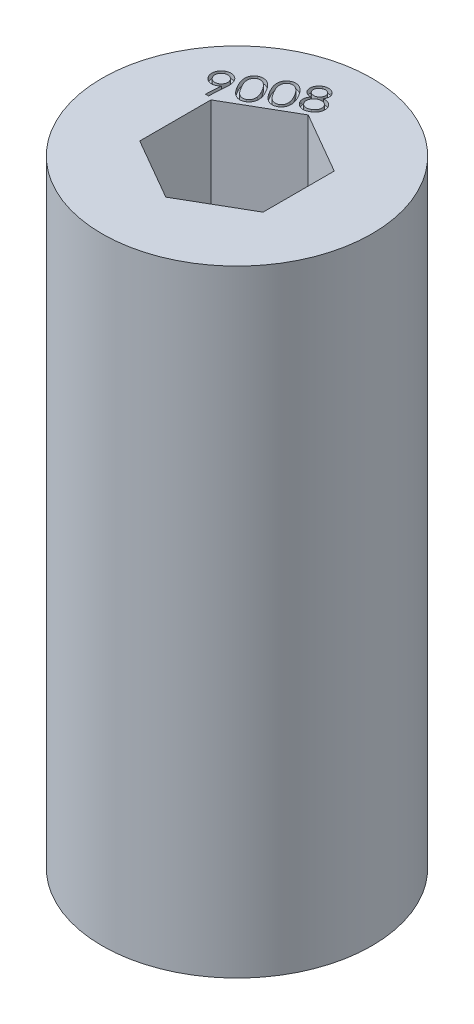
from build123d import *

# Parameters (mm, degrees)
SKETCH1_R           = 11.1125
BOSS_EXTRUDE1_DEPTH = 50.8
CUT_EXTRUDE1_DEPTH  = 0.4


with BuildPart() as part:
    # Sketch1 → Boss-Extrude1 (new body)
    with BuildSketch(Plane(origin=(0, 0, 0), x_dir=(1, 0, 0), z_dir=(0, 1, 0))):
        with Locations(Location((0, 0, 0), (0, 0, 270))):
            Circle(SKETCH1_R)
        Polygon((0, 5.865878735), (-5.08, 2.932939367), (-5.08, -2.932939367), (0, -5.865878735), (5.08, -2.932939367), (5.08, 2.932939367), align=None, mode=Mode.SUBTRACT)
    extrude(amount=BOSS_EXTRUDE1_DEPTH)

    # Sketch2 → Cut-Extrude1 (cut)
    # profile 1 of 4: a face of its own
    with BuildSketch(Plane(origin=(0, 50.8, 0), x_dir=(1, 0, 0), z_dir=(0, 1, 0))):
        with BuildLine():
            Line((-5.464233288, 3.106271191), (-5.712025756, 3.11848273))
            Line((-5.712025756, 3.11848273), (-5.638756525, 4.361515582))
            add(Edge.make_bspline(
                [(-5.638756525, 4.361515582), (-5.654742541, 4.34408663), (-5.685838885, 4.310183457), (-5.736339603, 4.265466689), (-5.786909982, 4.225649834), (-5.822721968, 4.20379365), (-5.84024691, 4.193098114)],
                knots=[0, 0, 0, 0, 1.07557127, 2.092224476, 3.066411598, 4, 4, 4, 4], degree=3))
            add(Edge.make_bspline(
                [(-5.84024691, 4.193098114), (-5.861905443, 4.181279532), (-5.904757805, 4.157895945), (-5.972054319, 4.131180701), (-6.040184027, 4.111394414), (-6.10936375, 4.100009922), (-6.179205016, 4.094550923), (-6.250185789, 4.097279675), (-6.321893014, 4.107639052), (-6.393746238, 4.124913062), (-6.464010388, 4.148529635), (-6.53100875, 4.178659981), (-6.593950569, 4.214920767), (-6.652582535, 4.257417881), (-6.707417297, 4.305484502), (-6.757937177, 4.359620171), (-6.804042025, 4.420135677), (-6.830938539, 4.463880923), (-6.844645948, 4.486175037)],
                knots=[0, 0, 0, 0, 1.015135184, 2.008489705, 2.974464217, 3.930823522, 4.890110555, 5.854468119, 6.84900024, 7.868689235, 8.893387844, 9.896732215, 10.888539014, 11.878968029, 12.873598221, 13.886496971, 14.922884625, 16, 16, 16, 16], degree=3))
            add(Edge.make_bspline(
                [(-6.844645948, 4.486175037), (-6.861489422, 4.517654922), (-6.89462857, 4.579590872), (-6.928183399, 4.678195714), (-6.95004064, 4.7778869), (-6.956050764, 4.878986517), (-6.950014984, 4.97987807), (-6.928546851, 5.07891092), (-6.894084706, 5.175574672), (-6.846407384, 5.268539991), (-6.787073873, 5.355536721), (-6.718339337, 5.434630756), (-6.639033964, 5.503366935), (-6.579910215, 5.540503596), (-6.550042583, 5.55926398)],
                knots=[0, 0, 0, 0, 1.035324533, 2.036977218, 3.013660684, 3.991039457, 4.968418229, 5.940283026, 6.923354643, 7.941094773, 8.965736768, 9.974485588, 10.976767849, 12, 12, 12, 12], degree=3))
            add(Edge.make_bspline(
                [(-6.550042583, 5.55926398), (-6.51957095, 5.575567897), (-6.459310938, 5.607810156), (-6.362638027, 5.640629179), (-6.263280159, 5.660753245), (-6.162026986, 5.667744951), (-6.060665863, 5.661961709), (-5.96175838, 5.641793645), (-5.865839738, 5.608535513), (-5.77518211, 5.560963725), (-5.690264574, 5.503300132), (-5.613904084, 5.435854133), (-5.547346225, 5.358895811), (-5.511353355, 5.301628285), (-5.493235692, 5.27280164)],
                knots=[0, 0, 0, 0, 1.019400264, 2.015942902, 3.002372847, 4.006779929, 5.005536382, 5.991966327, 6.979044859, 7.994053264, 9.007032045, 10.004279611, 10.995418019, 12, 12, 12, 12], degree=3))
            add(Edge.make_bspline(
                [(-5.493235692, 5.27280164), (-5.480740701, 5.249444054), (-5.455312696, 5.201910063), (-5.42504166, 5.125103763), (-5.400793373, 5.042801489), (-5.385071268, 4.970279705), (-5.375814114, 4.908612375), (-5.369989764, 4.85840008), (-5.366949763, 4.804715519), (-5.363998973, 4.747569389), (-5.3638075, 4.687150177), (-5.364814512, 4.623198069), (-5.36732965, 4.555845676), (-5.370174596, 4.509744836), (-5.371629121, 4.486175037)],
                knots=[0, 0, 0, 0, 1.179517641, 2.400384276, 3.669978525, 4.99951221, 5.702757638, 6.447991837, 7.250775919, 8.098000084, 8.997311831, 9.942054579, 10.947842213, 12, 12, 12, 12], degree=3))
            Line((-5.371629121, 4.486175037), (-5.464233288, 3.106271191))
        make_face()
        with BuildLine():
            add(Edge.make_bspline(
                [(-5.900795788, 4.414941063), (-5.88514732, 4.42446378), (-5.85441488, 4.443165694), (-5.812585098, 4.476242209), (-5.77446958, 4.511756411), (-5.741419829, 4.551327754), (-5.712214626, 4.593714055), (-5.687270228, 4.639265166), (-5.666086076, 4.687861045), (-5.650365153, 4.739333437), (-5.638317651, 4.791836686), (-5.632556762, 4.844566461), (-5.630618693, 4.896504821), (-5.634740047, 4.947896965), (-5.644703983, 4.998230386), (-5.658852589, 5.048126749), (-5.678837626, 5.097171444), (-5.695787063, 5.128614516), (-5.704393544, 5.144580486)],
                knots=[0, 0, 0, 0, 1.045108442, 2.052516081, 3.039037663, 4.014948609, 4.990090363, 5.974041511, 6.976128051, 8.011453109, 9.043011603, 10.047295345, 11.035574291, 12.007150616, 12.98344593, 13.961229243, 14.964765542, 16, 16, 16, 16], degree=3))
            add(Edge.make_bspline(
                [(-5.704393544, 5.144580486), (-5.713749183, 5.160054721), (-5.732239817, 5.190638244), (-5.765021987, 5.232272859), (-5.800881741, 5.269882455), (-5.840243743, 5.302972145), (-5.882681599, 5.332095795), (-5.928081699, 5.357218363), (-5.976939709, 5.377604273), (-6.028251361, 5.393593544), (-6.080830508, 5.405287058), (-6.13345449, 5.412156772), (-6.185475356, 5.413059533), (-6.236761796, 5.408959251), (-6.28748991, 5.39991044), (-6.337446419, 5.384762938), (-6.387156065, 5.365263493), (-6.418607621, 5.347796631), (-6.434541781, 5.338947473)],
                knots=[0, 0, 0, 0, 1.031712043, 2.039092063, 3.018573684, 3.994457873, 4.969572892, 5.953497063, 6.951758218, 7.98705489, 9.018585102, 10.024008046, 11.012022604, 11.983572292, 12.958061913, 13.947831088, 14.960318852, 16, 16, 16, 16], degree=3))
            add(Edge.make_bspline(
                [(-6.434541781, 5.338947473), (-6.450048329, 5.329631062), (-6.480581237, 5.311286739), (-6.52175729, 5.277968238), (-6.559879905, 5.242671466), (-6.592856414, 5.203041914), (-6.622204876, 5.16083074), (-6.646428382, 5.1149783), (-6.667765763, 5.066558569), (-6.683434864, 5.015057886), (-6.695496677, 4.962562222), (-6.701233977, 4.909999311), (-6.703190189, 4.858232177), (-6.699068034, 4.807009125), (-6.689107962, 4.756675798), (-6.674958314, 4.70677941), (-6.65497356, 4.657734721), (-6.638024083, 4.626291648), (-6.629417583, 4.610325678)],
                knots=[0, 0, 0, 0, 1.034021631, 2.036022986, 3.024725885, 4.002794686, 4.980092595, 5.961574923, 6.965877195, 8.00349148, 9.037330872, 10.043835206, 11.024597356, 11.998321951, 12.97677597, 13.956721278, 14.962476515, 16, 16, 16, 16], degree=3))
            add(Edge.make_bspline(
                [(-6.629417583, 4.610325678), (-6.620062349, 4.594850826), (-6.601572518, 4.564266083), (-6.568784497, 4.522640368), (-6.532946249, 4.48499806), (-6.493611883, 4.452119087), (-6.451596804, 4.422609013), (-6.406095382, 4.397841411), (-6.357519633, 4.376626967), (-6.306041644, 4.360914466), (-6.253539897, 4.348864703), (-6.200809733, 4.343104402), (-6.148871474, 4.34116618), (-6.097479303, 4.345287574), (-6.047145889, 4.355251499), (-5.997249524, 4.369400108), (-5.94820483, 4.389385145), (-5.916761757, 4.406334582), (-5.900795788, 4.414941063)],
                knots=[0, 0, 0, 0, 1.033571637, 2.042767394, 3.024014467, 4.001657624, 4.970548117, 5.956245748, 6.96011096, 7.997273687, 9.030663166, 10.03672948, 11.026762591, 12.000063433, 12.97809164, 13.957610489, 14.962928033, 16, 16, 16, 16], degree=3))
        make_face(mode=Mode.SUBTRACT)
    # profile 2 of 4: a face of its own
    with BuildSketch(Plane(origin=(0, 50.8, 0), x_dir=(1, 0, 0), z_dir=(0, 1, 0))):
        with BuildLine():
            add(Edge.make_bspline(
                [(-4.928687339, 4.954284012), (-4.948793485, 4.989588384), (-4.987897002, 5.058250228), (-5.040534024, 5.160657731), (-5.08765215, 5.258189022), (-5.127949969, 5.351356455), (-5.161795398, 5.439913028), (-5.188764868, 5.524041803), (-5.210138255, 5.603572354), (-5.224388486, 5.679306014), (-5.233119809, 5.751740457), (-5.237101698, 5.821413184), (-5.237356211, 5.888883823), (-5.232771229, 5.954186678), (-5.223705939, 6.01730867), (-5.209932829, 6.078228239), (-5.191476099, 6.136839676), (-5.169120362, 6.193332415), (-5.142952651, 6.247331226), (-5.111849294, 6.297693297), (-5.078678107, 6.345800774), (-5.041121008, 6.39000032), (-5.000873044, 6.431760197), (-4.956409405, 6.469583201), (-4.90905379, 6.505176436), (-4.875108239, 6.525780064), (-4.857962178, 6.536187056)],
                knots=[0, 0, 0, 0, 1.642217524, 3.193873097, 4.653599743, 6.020219012, 7.296149585, 8.484364078, 9.590266645, 10.622995624, 11.596731579, 12.537641419, 13.442669779, 14.322439731, 15.181528583, 16.018162769, 16.844365298, 17.663022962, 18.472528165, 19.266229043, 20.053716379, 20.832379209, 21.608138827, 22.395685855, 23.18965321, 24, 24, 24, 24], degree=3))
            add(Edge.make_bspline(
                [(-4.857962178, 6.536187056), (-4.84013454, 6.545988782), (-4.804791488, 6.565420571), (-4.749447636, 6.58905243), (-4.69370601, 6.609216691), (-4.636620844, 6.623997977), (-4.578762578, 6.634121613), (-4.519731728, 6.639774528), (-4.459848145, 6.640750937), (-4.399144164, 6.637089566), (-4.337812434, 6.62914793), (-4.276399155, 6.615310678), (-4.215177301, 6.596125234), (-4.153605772, 6.57299638), (-4.092924308, 6.543097982), (-4.031973214, 6.508743479), (-3.970843719, 6.469752408), (-3.910268702, 6.424544749), (-3.849003653, 6.373917511), (-3.788382954, 6.31590064), (-3.727494497, 6.250915058), (-3.667251705, 6.178716746), (-3.607196679, 6.099335471), (-3.546422586, 6.01346862), (-3.486709796, 5.919760167), (-3.448017599, 5.85432078), (-3.42819455, 5.820794428)],
                knots=[0, 0, 0, 0, 0.815881076, 1.617473213, 2.411751612, 3.192532544, 3.980223438, 4.766442947, 5.569622482, 6.380892254, 7.204795063, 8.048528362, 8.903143009, 9.777765604, 10.684831081, 11.614241792, 12.584586996, 13.591843045, 14.645331516, 15.771781295, 16.956234458, 18.217113798, 19.542884518, 20.949560407, 22.437178076, 24, 24, 24, 24], degree=3))
            add(Edge.make_bspline(
                [(-3.42819455, 5.820794428), (-3.409190702, 5.7869722), (-3.372127599, 5.721008888), (-3.320894818, 5.622901727), (-3.276888393, 5.527798763), (-3.23825745, 5.436480652), (-3.206313147, 5.348637361), (-3.179966056, 5.264332003), (-3.160056454, 5.183454138), (-3.146053551, 5.105772295), (-3.138263238, 5.030928089), (-3.133631325, 4.95892004), (-3.135060527, 4.88924104), (-3.139639736, 4.821845386), (-3.150151576, 4.756797379), (-3.164166869, 4.693954868), (-3.18303456, 4.633690481), (-3.20660177, 4.576124872), (-3.233843758, 4.521260537), (-3.265334897, 4.46972113), (-3.299144903, 4.420716259), (-3.336912934, 4.37504797), (-3.379107514, 4.333531697), (-3.423647626, 4.294224214), (-3.47185414, 4.258099281), (-3.506363462, 4.237247043), (-3.523851601, 4.226679845)],
                knots=[0, 0, 0, 0, 1.558572261, 3.039675171, 4.44500239, 5.767404933, 7.021920233, 8.19867626, 9.314183841, 10.366093107, 11.366862767, 12.335955634, 13.262731656, 14.164729598, 15.047477431, 15.907015182, 16.749641984, 17.580952634, 18.403702246, 19.207672054, 20.005351578, 20.794016824, 21.584181799, 22.380929523, 23.179510693, 24, 24, 24, 24], degree=3))
            add(Edge.make_bspline(
                [(-3.523851601, 4.226679845), (-3.541367865, 4.217115449), (-3.576147998, 4.198124471), (-3.630084616, 4.174010379), (-3.685420625, 4.15543098), (-3.741225332, 4.140280622), (-3.798182967, 4.130921886), (-3.855799048, 4.125083823), (-3.914496656, 4.12422767), (-3.973914032, 4.127567424), (-4.03355512, 4.13656122), (-4.093299441, 4.149399628), (-4.152422207, 4.168795119), (-4.211709801, 4.192092469), (-4.270804517, 4.220821596), (-4.329860864, 4.254356104), (-4.388455415, 4.293401204), (-4.447492568, 4.337214273), (-4.506145932, 4.388061163), (-4.565467307, 4.445960184), (-4.625319129, 4.511487517), (-4.685255803, 4.585124536), (-4.745975243, 4.666184451), (-4.806581705, 4.755280679), (-4.868578792, 4.851586182), (-4.90824727, 4.919361346), (-4.928687339, 4.954284012)],
                knots=[0, 0, 0, 0, 0.807491903, 1.603348545, 2.386916451, 3.167713854, 3.940658363, 4.719915701, 5.50935356, 6.313835313, 7.125313705, 7.947948844, 8.783651521, 9.640150085, 10.524255013, 11.440287308, 12.386399569, 13.372019105, 14.413529699, 15.525036669, 16.724996316, 18.002813491, 19.365932914, 20.822335035, 22.362637201, 24, 24, 24, 24], degree=3))
        make_face()
        with BuildLine():
            add(Edge.make_bspline(
                [(-4.718547114, 5.069784813), (-4.70108648, 5.039827411), (-4.667275062, 4.981816791), (-4.615222732, 4.899258903), (-4.564339812, 4.823520983), (-4.515229323, 4.75413604), (-4.466971574, 4.691884002), (-4.419519097, 4.636916859), (-4.37381687, 4.588199154), (-4.328724806, 4.546096025), (-4.283896023, 4.509550177), (-4.239087362, 4.477336139), (-4.193809127, 4.449386933), (-4.148466892, 4.42530407), (-4.102694317, 4.405313478), (-4.056733088, 4.388831973), (-4.010111692, 4.377351461), (-3.94905364, 4.366415974), (-3.874075679, 4.362228962), (-3.787437682, 4.37088435), (-3.705448212, 4.392270684), (-3.65593415, 4.417572222), (-3.631211377, 4.430205486)],
                knots=[0, 0, 0, 0, 1.475228016, 2.856686104, 4.15161897, 5.357081144, 6.47289893, 7.501387829, 8.445726694, 9.313720896, 10.124066195, 10.905058304, 11.660046733, 12.386348828, 13.08755313, 13.783651734, 14.460982071, 15.127735434, 16.421461315, 17.639985157, 18.821625413, 20, 20, 20, 20], degree=3))
            add(Edge.make_bspline(
                [(-3.631211377, 4.430205486), (-3.607710095, 4.445359707), (-3.560973482, 4.475496658), (-3.501138516, 4.535227097), (-3.451132416, 4.605126996), (-3.417699965, 4.67090562), (-3.397074331, 4.728014329), (-3.384042229, 4.773303827), (-3.375688418, 4.820890891), (-3.370374372, 4.870198879), (-3.369820308, 4.921398884), (-3.371555498, 4.974441182), (-3.377801327, 5.029337053), (-3.384559059, 5.066258827), (-3.387998236, 5.085049236)],
                knots=[0, 0, 0, 0, 1.342886321, 2.670576022, 4.038999414, 5.466462105, 6.205051725, 6.959707281, 7.731476591, 8.527516338, 9.344012544, 10.193626534, 11.080691652, 12, 12, 12, 12], degree=3))
            add(Edge.make_bspline(
                [(-3.387998236, 5.085049236), (-3.392801514, 5.108860677), (-3.402577303, 5.157322507), (-3.422901628, 5.230025483), (-3.446791032, 5.30461487), (-3.475175086, 5.380502959), (-3.508171229, 5.457724584), (-3.544673502, 5.536619378), (-3.585892775, 5.617095001), (-3.616251638, 5.670467085), (-3.631720191, 5.697661415)],
                knots=[0, 0, 0, 0, 0.879876913, 1.790754508, 2.73331625, 3.717259664, 4.725112015, 5.77538776, 6.866507818, 8, 8, 8, 8], degree=3))
            add(Edge.make_bspline(
                [(-3.631720191, 5.697661415), (-3.647453671, 5.724587266), (-3.678237596, 5.777270043), (-3.726831457, 5.852249655), (-3.774472981, 5.92287403), (-3.822793775, 5.988121293), (-3.871695744, 6.0479169), (-3.91994551, 6.103347831), (-3.968824147, 6.153162936), (-4.017781593, 6.19812882), (-4.066624645, 6.238253262), (-4.114791843, 6.274124811), (-4.163081279, 6.304758041), (-4.210816348, 6.331487525), (-4.258543059, 6.353215883), (-4.3057272, 6.370883174), (-4.352730646, 6.383729554), (-4.41398708, 6.394172282), (-4.488519222, 6.398470643), (-4.574584024, 6.390621994), (-4.655780875, 6.369035549), (-4.704835434, 6.344063418), (-4.72923221, 6.331643787)],
                knots=[0, 0, 0, 0, 1.327522451, 2.597413504, 3.803087542, 4.954092809, 6.052504639, 7.091116491, 8.08170511, 9.022070092, 9.919800897, 10.771882377, 11.577119672, 12.352806521, 13.099205072, 13.807429758, 14.495830891, 15.170113202, 16.450227669, 17.661618134, 18.837030004, 20, 20, 20, 20], degree=3))
            add(Edge.make_bspline(
                [(-4.72923221, 6.331643787), (-4.752768129, 6.316521097), (-4.799674133, 6.28638227), (-4.8592186, 6.225893802), (-4.910252136, 6.155599587), (-4.943263344, 6.08855477), (-4.965224395, 6.030984494), (-4.977011098, 5.984968735), (-4.986395219, 5.937447555), (-4.99210498, 5.887932881), (-4.993156653, 5.836569144), (-4.992055344, 5.783509077), (-4.985872707, 5.728876939), (-4.977526021, 5.671848526), (-4.963998074, 5.611639902), (-4.944976408, 5.547456033), (-4.92025291, 5.47884545), (-4.890752643, 5.4054349), (-4.855506683, 5.327826709), (-4.815021598, 5.245587731), (-4.769487317, 5.158729475), (-4.735872529, 5.100036031), (-4.718547114, 5.069784813)],
                knots=[0, 0, 0, 0, 1.186584607, 2.364808541, 3.584028067, 4.867913378, 5.52979883, 6.201670858, 6.884946004, 7.589109066, 8.317961587, 9.068444384, 9.84432244, 10.65432116, 11.518850237, 12.466086659, 13.499587148, 14.619373863, 15.830028341, 17.123623296, 18.517485242, 20, 20, 20, 20], degree=3))
        make_face(mode=Mode.SUBTRACT)
    # profile 3 of 4: a face of its own
    with BuildSketch(Plane(origin=(0, 50.8, 0), x_dir=(1, 0, 0), z_dir=(0, 1, 0))):
        with BuildLine():
            add(Edge.make_bspline(
                [(-3.236606934, 5.931207088), (-3.256713081, 5.96651146), (-3.295816598, 6.035173305), (-3.348453619, 6.137580808), (-3.395571746, 6.235112098), (-3.435869564, 6.328279532), (-3.469714994, 6.416836105), (-3.496684464, 6.50096488), (-3.518057851, 6.580495431), (-3.532308082, 6.656229091), (-3.541039405, 6.728663534), (-3.545021294, 6.798336261), (-3.545275807, 6.8658069), (-3.540690825, 6.931109755), (-3.531625534, 6.994231747), (-3.517852425, 7.055151315), (-3.499395695, 7.113762753), (-3.477039958, 7.170255492), (-3.450872246, 7.224254303), (-3.41976889, 7.274616373), (-3.386597703, 7.322723851), (-3.349040604, 7.366923397), (-3.30879264, 7.408683274), (-3.264329, 7.446506278), (-3.216973386, 7.482099513), (-3.183027835, 7.502703141), (-3.165881774, 7.513110133)],
                knots=[0, 0, 0, 0, 1.642217524, 3.193873097, 4.653599743, 6.020219012, 7.296149585, 8.484364078, 9.590266645, 10.622995624, 11.596731579, 12.537641419, 13.442669779, 14.322439731, 15.181528583, 16.018162769, 16.844365298, 17.663022962, 18.472528165, 19.266229043, 20.053716379, 20.832379209, 21.608138827, 22.395685855, 23.18965321, 24, 24, 24, 24], degree=3))
            add(Edge.make_bspline(
                [(-3.165881774, 7.513110133), (-3.148054136, 7.522911859), (-3.112711083, 7.542343648), (-3.057367231, 7.565975507), (-3.001625606, 7.586139768), (-2.94454044, 7.600921054), (-2.886682174, 7.61104469), (-2.827651324, 7.616697605), (-2.76776774, 7.617674014), (-2.70706376, 7.614012643), (-2.645732029, 7.606071007), (-2.584318751, 7.592233755), (-2.523096897, 7.573048311), (-2.461525367, 7.549919457), (-2.400843903, 7.520021059), (-2.339892809, 7.485666556), (-2.278763315, 7.446675485), (-2.218188298, 7.401467826), (-2.156923249, 7.350840588), (-2.09630255, 7.292823717), (-2.035414092, 7.227838135), (-1.975171301, 7.155639823), (-1.915116275, 7.076258548), (-1.854342182, 6.990391697), (-1.794629391, 6.896683244), (-1.755937195, 6.831243857), (-1.736114146, 6.797717505)],
                knots=[0, 0, 0, 0, 0.815881076, 1.617473213, 2.411751612, 3.192532544, 3.980223438, 4.766442947, 5.569622482, 6.380892254, 7.204795063, 8.048528362, 8.903143009, 9.777765604, 10.684831081, 11.614241792, 12.584586996, 13.591843045, 14.645331516, 15.771781295, 16.956234458, 18.217113798, 19.542884518, 20.949560407, 22.437178076, 24, 24, 24, 24], degree=3))
            add(Edge.make_bspline(
                [(-1.736114146, 6.797717505), (-1.717110298, 6.763895277), (-1.680047195, 6.697931965), (-1.628814413, 6.599824804), (-1.584807988, 6.504721839), (-1.546177046, 6.413403729), (-1.514232743, 6.325560438), (-1.487885652, 6.24125508), (-1.46797605, 6.160377215), (-1.453973146, 6.082695372), (-1.446182834, 6.007851166), (-1.44155092, 5.935843116), (-1.442980123, 5.866164117), (-1.447559332, 5.798768463), (-1.458071172, 5.733720456), (-1.472086465, 5.670877945), (-1.490954156, 5.610613558), (-1.514521365, 5.553047949), (-1.541763353, 5.498183614), (-1.573254493, 5.446644207), (-1.607064499, 5.397639336), (-1.644832529, 5.351971047), (-1.687027109, 5.310454774), (-1.731567222, 5.271147291), (-1.779773736, 5.235022357), (-1.814283058, 5.21417012), (-1.831771197, 5.203602922)],
                knots=[0, 0, 0, 0, 1.558572261, 3.039675171, 4.44500239, 5.767404933, 7.021920233, 8.19867626, 9.314183841, 10.366093107, 11.366862767, 12.335955634, 13.262731656, 14.164729598, 15.047477431, 15.907015182, 16.749641984, 17.580952634, 18.403702246, 19.207672054, 20.005351578, 20.794016824, 21.584181799, 22.380929523, 23.179510693, 24, 24, 24, 24], degree=3))
            add(Edge.make_bspline(
                [(-1.831771197, 5.203602922), (-1.849287461, 5.194038526), (-1.884067594, 5.175047548), (-1.938004212, 5.150933456), (-1.993340221, 5.132354057), (-2.049144928, 5.117203699), (-2.106102563, 5.107844963), (-2.163718644, 5.1020069), (-2.222416251, 5.101150747), (-2.281833628, 5.104490501), (-2.341474716, 5.113484297), (-2.401219037, 5.126322705), (-2.460341803, 5.145718195), (-2.519629397, 5.169015546), (-2.578724112, 5.197744673), (-2.63778046, 5.231279181), (-2.696375011, 5.270324281), (-2.755412164, 5.31413735), (-2.814065528, 5.36498424), (-2.873386903, 5.422883261), (-2.933238725, 5.488410594), (-2.993175399, 5.562047613), (-3.053894839, 5.643107528), (-3.114501301, 5.732203756), (-3.176498388, 5.828509259), (-3.216166866, 5.896284423), (-3.236606934, 5.931207088)],
                knots=[0, 0, 0, 0, 0.807491903, 1.603348545, 2.386916451, 3.167713854, 3.940658363, 4.719915701, 5.50935356, 6.313835313, 7.125313705, 7.947948844, 8.783651521, 9.640150085, 10.524255013, 11.440287308, 12.386399569, 13.372019105, 14.413529699, 15.525036669, 16.724996316, 18.002813491, 19.365932914, 20.822335035, 22.362637201, 24, 24, 24, 24], degree=3))
        make_face()
        with BuildLine():
            add(Edge.make_bspline(
                [(-3.02646671, 6.04670789), (-3.009006076, 6.016750488), (-2.975194658, 5.958739868), (-2.923142328, 5.87618198), (-2.872259407, 5.80044406), (-2.823148919, 5.731059117), (-2.774891169, 5.668807079), (-2.727438693, 5.613839936), (-2.681736466, 5.565122231), (-2.636644402, 5.523019102), (-2.591815618, 5.486473254), (-2.547006958, 5.454259216), (-2.501728723, 5.42631001), (-2.456386487, 5.402227147), (-2.410613913, 5.382236555), (-2.364652683, 5.36575505), (-2.318031287, 5.354274538), (-2.256973236, 5.343339051), (-2.181995274, 5.339152038), (-2.095357278, 5.347807427), (-2.013367807, 5.369193761), (-1.963853746, 5.394495299), (-1.939130973, 5.407128563)],
                knots=[0, 0, 0, 0, 1.475228016, 2.856686104, 4.15161897, 5.357081144, 6.47289893, 7.501387829, 8.445726694, 9.313720896, 10.124066195, 10.905058304, 11.660046733, 12.386348828, 13.08755313, 13.783651734, 14.460982071, 15.127735434, 16.421461315, 17.639985157, 18.821625413, 20, 20, 20, 20], degree=3))
            add(Edge.make_bspline(
                [(-1.939130973, 5.407128563), (-1.915629691, 5.422282784), (-1.868893077, 5.452419735), (-1.809058111, 5.512150174), (-1.759052012, 5.582050073), (-1.725619561, 5.647828697), (-1.704993927, 5.704937406), (-1.691961825, 5.750226904), (-1.683608014, 5.797813968), (-1.678293967, 5.847121956), (-1.677739904, 5.898321961), (-1.679475094, 5.951364259), (-1.685720923, 6.00626013), (-1.692478654, 6.043181904), (-1.695917832, 6.061972313)],
                knots=[0, 0, 0, 0, 1.342886321, 2.670576022, 4.038999414, 5.466462105, 6.205051725, 6.959707281, 7.731476591, 8.527516338, 9.344012544, 10.193626534, 11.080691652, 12, 12, 12, 12], degree=3))
            add(Edge.make_bspline(
                [(-1.695917832, 6.061972313), (-1.70072111, 6.085783754), (-1.710496899, 6.134245584), (-1.730821224, 6.20694856), (-1.754710628, 6.281537947), (-1.783094682, 6.357426036), (-1.816090825, 6.434647661), (-1.852593098, 6.513542455), (-1.893812371, 6.594018078), (-1.924171233, 6.647390162), (-1.939639787, 6.674584492)],
                knots=[0, 0, 0, 0, 0.879876913, 1.790754508, 2.73331625, 3.717259664, 4.725112015, 5.77538776, 6.866507818, 8, 8, 8, 8], degree=3))
            add(Edge.make_bspline(
                [(-1.939639787, 6.674584492), (-1.955373266, 6.701510343), (-1.986157192, 6.75419312), (-2.034751052, 6.829172732), (-2.082392577, 6.899797107), (-2.130713371, 6.96504437), (-2.17961534, 7.024839977), (-2.227865106, 7.080270908), (-2.276743743, 7.130086013), (-2.325701188, 7.175051897), (-2.37454424, 7.215176339), (-2.422711439, 7.251047887), (-2.471000875, 7.281681118), (-2.518735944, 7.308410601), (-2.566462655, 7.33013896), (-2.613646796, 7.34780625), (-2.660650242, 7.360652631), (-2.721906675, 7.371095358), (-2.796438818, 7.37539372), (-2.88250362, 7.367545071), (-2.96370047, 7.345958626), (-3.012755029, 7.320986495), (-3.037151806, 7.308566864)],
                knots=[0, 0, 0, 0, 1.327522451, 2.597413504, 3.803087542, 4.954092809, 6.052504639, 7.091116491, 8.08170511, 9.022070092, 9.919800897, 10.771882377, 11.577119672, 12.352806521, 13.099205072, 13.807429758, 14.495830891, 15.170113202, 16.450227669, 17.661618134, 18.837030004, 20, 20, 20, 20], degree=3))
            add(Edge.make_bspline(
                [(-3.037151806, 7.308566864), (-3.060687725, 7.293444174), (-3.107593729, 7.263305347), (-3.167138195, 7.202816879), (-3.218171731, 7.132522664), (-3.25118294, 7.065477847), (-3.27314399, 7.007907571), (-3.284930694, 6.961891811), (-3.294314814, 6.914370632), (-3.300024575, 6.864855958), (-3.301076249, 6.813492221), (-3.29997494, 6.760432154), (-3.293792303, 6.705800016), (-3.285445616, 6.648771603), (-3.27191767, 6.588562979), (-3.252896003, 6.52437911), (-3.228172506, 6.455768527), (-3.198672238, 6.382357977), (-3.163426279, 6.304749786), (-3.122941194, 6.222510808), (-3.077406913, 6.135652552), (-3.043792125, 6.076959107), (-3.02646671, 6.04670789)],
                knots=[0, 0, 0, 0, 1.186584607, 2.364808541, 3.584028067, 4.867913378, 5.52979883, 6.201670858, 6.884946004, 7.589109066, 8.317961587, 9.068444384, 9.84432244, 10.65432116, 11.518850237, 12.466086659, 13.499587148, 14.619373863, 15.830028341, 17.123623296, 18.517485242, 20, 20, 20, 20], degree=3))
        make_face(mode=Mode.SUBTRACT)
    # profile 4 of 4: a face of its own
    with BuildSketch(Plane(origin=(0, 50.8, 0), x_dir=(1, 0, 0), z_dir=(0, 1, 0))):
        with BuildLine():
            add(Edge.make_bspline(
                [(-0.527407139, 7.639296031), (-0.504010252, 7.640556783), (-0.458423594, 7.643013241), (-0.391647289, 7.642556539), (-0.32835572, 7.638180841), (-0.268457208, 7.632095947), (-0.211857984, 7.621723381), (-0.158776285, 7.60820436), (-0.108976428, 7.591251624), (-0.06246804, 7.571468435), (-0.018895167, 7.548227225), (0.022438847, 7.522442631), (0.061046494, 7.493086004), (0.098135002, 7.461693469), (0.131962286, 7.426416531), (0.163730779, 7.388498761), (0.19341163, 7.347743506), (0.211083982, 7.318704992), (0.220040778, 7.303987537)],
                knots=[0, 0, 0, 0, 1.29337139, 2.520013907, 3.683490667, 4.79505804, 5.841919162, 6.857061423, 7.816434108, 8.743459039, 9.644003027, 10.540253109, 11.429777109, 12.31944894, 13.219992929, 14.123937958, 15.049164217, 16, 16, 16, 16], degree=3))
            add(Edge.make_bspline(
                [(0.220040778, 7.303987537), (0.231600464, 7.282800599), (0.254450446, 7.24092047), (0.282075086, 7.17539734), (0.302887669, 7.108536937), (0.317701469, 7.040608589), (0.326567506, 6.971650638), (0.328318309, 6.901646956), (0.324492079, 6.830452113), (0.316970205, 6.783082179), (0.313153758, 6.759047633)],
                knots=[0, 0, 0, 0, 1.024860602, 2.025837477, 3.014866166, 3.995672133, 4.976054564, 5.963586137, 6.966764814, 8, 8, 8, 8], degree=3))
            add(Edge.make_bspline(
                [(0.313153758, 6.759047633), (0.306738776, 6.730015614), (0.293982348, 6.672284383), (0.262330409, 6.589463835), (0.221283801, 6.510956656), (0.170464333, 6.436612823), (0.109552353, 6.366745436), (0.038613454, 6.301544092), (-0.041371419, 6.239986714), (-0.10030486, 6.204383853), (-0.130532139, 6.186122954)],
                knots=[0, 0, 0, 0, 0.951809638, 1.892708267, 2.831154507, 3.78547507, 4.771826231, 5.79490486, 6.86899481, 8, 8, 8, 8], degree=3))
            add(Edge.make_bspline(
                [(-0.130532139, 6.186122954), (-0.160465666, 6.169667472), (-0.218575005, 6.137722784), (-0.30752205, 6.099596784), (-0.394343512, 6.070364117), (-0.479906739, 6.052113519), (-0.563771967, 6.042597627), (-0.64615529, 6.042847904), (-0.726575556, 6.053817902), (-0.80442254, 6.073797071), (-0.878334007, 6.101325146), (-0.948054718, 6.133541341), (-1.012805506, 6.169946507), (-1.072368502, 6.211602624), (-1.126925443, 6.257751959), (-1.175919821, 6.309105433), (-1.220366417, 6.364698364), (-1.2450897, 6.405301813), (-1.257555376, 6.425774396)],
                knots=[0, 0, 0, 0, 1.270026794, 2.465476854, 3.594745598, 4.672594824, 5.713526503, 6.72933635, 7.728711384, 8.724894793, 9.712953326, 10.658605395, 11.579691981, 12.472334685, 13.358555014, 14.233155391, 15.109142851, 16, 16, 16, 16], degree=3))
            add(Edge.make_bspline(
                [(-1.257555376, 6.425774396), (-1.273837082, 6.456365545), (-1.30595032, 6.516702026), (-1.336028017, 6.614104049), (-1.352221754, 6.713441073), (-1.353016957, 6.797934253), (-1.345868774, 6.866622614), (-1.334800318, 6.919802353), (-1.319454314, 6.974355384), (-1.299584365, 7.030288725), (-1.274889663, 7.087447075), (-1.245847877, 7.146135066), (-1.211649569, 7.206133706), (-1.186164042, 7.245925596), (-1.173092235, 7.266335294)],
                knots=[0, 0, 0, 0, 1.389648907, 2.740875326, 4.072875771, 5.422159229, 6.12123927, 6.844220769, 7.60145763, 8.396738155, 9.227066437, 10.101678336, 11.026329941, 12, 12, 12, 12], degree=3))
            add(Edge.make_bspline(
                [(-1.173092235, 7.266335294), (-1.206875652, 7.265649316), (-1.272307152, 7.264320719), (-1.367187436, 7.27642265), (-1.455075362, 7.298540803), (-1.535384556, 7.331752813), (-1.607769085, 7.374612699), (-1.670901032, 7.426609476), (-1.727064483, 7.485279945), (-1.755578524, 7.530868225), (-1.769931177, 7.553815262)],
                knots=[0, 0, 0, 0, 1.160149589, 2.246970107, 3.276342679, 4.266966819, 5.223786376, 6.156139075, 7.071885456, 8, 8, 8, 8], degree=3))
            add(Edge.make_bspline(
                [(-1.769931177, 7.553815262), (-1.782559879, 7.578250375), (-1.808016585, 7.627506231), (-1.832660788, 7.708321984), (-1.845780447, 7.794323774), (-1.847525349, 7.884254506), (-1.838455729, 7.975783139), (-1.815232532, 8.065733828), (-1.78132671, 8.153482847), (-1.733873174, 8.237066854), (-1.67725188, 8.316278117), (-1.609578769, 8.387017939), (-1.534683761, 8.45142464), (-1.478388145, 8.486176971), (-1.449887107, 8.503771191)],
                knots=[0, 0, 0, 0, 0.890613648, 1.795282768, 2.724940844, 3.704285962, 4.705355874, 5.697911828, 6.708127967, 7.747266194, 8.806818375, 9.857437861, 10.915275324, 12, 12, 12, 12], degree=3))
            add(Edge.make_bspline(
                [(-1.449887107, 8.503771191), (-1.421036639, 8.51903541), (-1.364089837, 8.549164852), (-1.273617028, 8.582254267), (-1.180363998, 8.601733129), (-1.085769796, 8.610498833), (-0.991660919, 8.607804567), (-0.900384358, 8.592226286), (-0.812988119, 8.565777328), (-0.730861804, 8.527519993), (-0.655464969, 8.479906558), (-0.587715163, 8.424575285), (-0.529539023, 8.360828673), (-0.498924374, 8.312604424), (-0.483649126, 8.288542826)],
                knots=[0, 0, 0, 0, 1.069510487, 2.111064653, 3.146258965, 4.185032694, 5.220032767, 6.2239636, 7.212682009, 8.205536975, 9.18534606, 10.129594448, 11.066756907, 12, 12, 12, 12], degree=3))
            add(Edge.make_bspline(
                [(-0.483649126, 8.288542826), (-0.470516398, 8.263611317), (-0.444818472, 8.214825714), (-0.41951031, 8.13668676), (-0.407450116, 8.056991101), (-0.406796247, 7.975705572), (-0.419056105, 7.893044117), (-0.442842382, 7.808963911), (-0.478834255, 7.723230316), (-0.510817855, 7.667962431), (-0.527407139, 7.639296031)],
                knots=[0, 0, 0, 0, 0.984189045, 1.925846447, 2.856208099, 3.793427362, 4.758118434, 5.768450775, 6.842537891, 8, 8, 8, 8], degree=3))
        make_face()
        with BuildLine():
            add(Edge.make_bspline(
                [(-1.336421562, 8.284472313), (-1.350982501, 8.275531284), (-1.379598055, 8.257960131), (-1.419268486, 8.228373725), (-1.455307501, 8.196818769), (-1.48682429, 8.162427363), (-1.515003031, 8.126350041), (-1.539204859, 8.087897629), (-1.55893177, 8.046968777), (-1.575013878, 8.004567672), (-1.587602879, 7.961593945), (-1.594163403, 7.918658332), (-1.598481376, 7.876813147), (-1.596461182, 7.835870265), (-1.591305714, 7.795622128), (-1.580000018, 7.756674105), (-1.566186261, 7.717726391), (-1.552849317, 7.693410083), (-1.546052972, 7.681018787)],
                knots=[0, 0, 0, 0, 1.152886437, 2.265683783, 3.336219627, 4.381293113, 5.409487545, 6.422787264, 7.441698017, 8.47078437, 9.481947622, 10.456881218, 11.399067283, 12.315585865, 13.217399986, 14.131125717, 15.047644299, 16, 16, 16, 16], degree=3))
            add(Edge.make_bspline(
                [(-1.546052972, 7.681018787), (-1.538693974, 7.669124198), (-1.524037506, 7.64543447), (-1.497329918, 7.613508626), (-1.467502213, 7.58442363), (-1.433730177, 7.559253465), (-1.396753097, 7.536439288), (-1.355986318, 7.517458417), (-1.312029386, 7.500871228), (-1.265070305, 7.488669349), (-1.21703554, 7.479179309), (-1.168924066, 7.475362116), (-1.121797498, 7.475327818), (-1.075192319, 7.479102113), (-1.029598851, 7.488517004), (-0.984776712, 7.501834962), (-0.940745785, 7.51963082), (-0.912612764, 7.534880639), (-0.89833262, 7.542621351)],
                knots=[0, 0, 0, 0, 0.918485927, 1.829292468, 2.728214981, 3.651426008, 4.592243916, 5.579737702, 6.602846041, 7.676586022, 8.765615827, 9.817482226, 10.843260286, 11.861801834, 12.885153163, 13.897573612, 14.932821615, 16, 16, 16, 16], degree=3))
            add(Edge.make_bspline(
                [(-0.89833262, 7.542621351), (-0.880731779, 7.553730241), (-0.845720274, 7.57582799), (-0.79857823, 7.616517477), (-0.757184411, 7.663166467), (-0.721679028, 7.71498954), (-0.692846864, 7.770477777), (-0.671467659, 7.82852603), (-0.659255299, 7.888754867), (-0.655575062, 7.949809988), (-0.658278897, 8.00997902), (-0.668627401, 8.067171135), (-0.684888696, 8.120988955), (-0.702075316, 8.153427782), (-0.710580216, 8.169480326)],
                knots=[0, 0, 0, 0, 1.033697066, 2.056225056, 3.083505224, 4.126651397, 5.171330081, 6.184953449, 7.192067322, 8.214595312, 9.219305906, 10.178655603, 11.098697045, 12, 12, 12, 12], degree=3))
            add(Edge.make_bspline(
                [(-0.710580216, 8.169480326), (-0.717065577, 8.180377544), (-0.729971342, 8.202062833), (-0.754654861, 8.230810405), (-0.780752077, 8.25820426), (-0.81089276, 8.282029743), (-0.843267377, 8.304161767), (-0.879272089, 8.322870925), (-0.918081419, 8.339177112), (-0.959540565, 8.352789316), (-1.002828852, 8.363345851), (-1.047816196, 8.367708643), (-1.093745259, 8.36733811), (-1.140640365, 8.360986652), (-1.18846086, 8.349535752), (-1.237160666, 8.33323036), (-1.287083063, 8.311682803), (-1.3196052, 8.293746642), (-1.336421562, 8.284472313)],
                knots=[0, 0, 0, 0, 0.854903353, 1.701243958, 2.55183814, 3.40704846, 4.29034055, 5.197382862, 6.142058831, 7.13105355, 8.142549916, 9.144530092, 10.175622829, 11.23849134, 12.333292227, 13.492545658, 14.703459688, 16, 16, 16, 16], degree=3))
        make_face(mode=Mode.SUBTRACT)
        with BuildLine():
            add(Edge.make_bspline(
                [(-0.780287748, 7.34520148), (-0.798662535, 7.334183044), (-0.834794742, 7.312516379), (-0.884332584, 7.274555297), (-0.928725302, 7.23309438), (-0.968623024, 7.188820321), (-1.003605011, 7.141201494), (-1.032984021, 7.089981807), (-1.058237599, 7.03580985), (-1.0778089, 6.978799918), (-1.091652661, 6.920785384), (-1.101316411, 6.863528924), (-1.104473111, 6.807369943), (-1.101088964, 6.752523358), (-1.093297008, 6.698684245), (-1.07873539, 6.646236919), (-1.059070007, 6.594920686), (-1.041511496, 6.562638227), (-1.032659543, 6.546363338)],
                knots=[0, 0, 0, 0, 1.104006722, 2.17092026, 3.210423596, 4.232230544, 5.239717318, 6.250651869, 7.271859912, 8.31723205, 9.352275006, 10.344271946, 11.307640776, 12.244814937, 13.173628623, 14.107041644, 15.045683453, 16, 16, 16, 16], degree=3))
            add(Edge.make_bspline(
                [(-1.032659543, 6.546363338), (-1.020324211, 6.526793093), (-0.995802444, 6.48788883), (-0.94912989, 6.4367038), (-0.895586825, 6.392091559), (-0.835718302, 6.353981431), (-0.770455457, 6.323881568), (-0.70109713, 6.304083047), (-0.629032393, 6.293678676), (-0.554361781, 6.293907043), (-0.477998221, 6.304345915), (-0.400758404, 6.324319982), (-0.323076233, 6.354672425), (-0.273232353, 6.381788005), (-0.247559383, 6.395754364)],
                knots=[0, 0, 0, 0, 0.92981528, 1.848407044, 2.774202569, 3.72885555, 4.697398384, 5.656849443, 6.622451667, 7.619316134, 8.652555635, 9.717392068, 10.824302462, 12, 12, 12, 12], degree=3))
            add(Edge.make_bspline(
                [(-0.247559383, 6.395754364), (-0.228157967, 6.407444277), (-0.190380631, 6.430206211), (-0.138836288, 6.469520733), (-0.092026171, 6.510366235), (-0.05195828, 6.55499699), (-0.016749789, 6.601546847), (0.012408779, 6.651247383), (0.035728426, 6.703709652), (0.053545007, 6.758127285), (0.06549129, 6.813254158), (0.07275241, 6.867887258), (0.074967991, 6.921562812), (0.071457845, 6.974295715), (0.062041615, 7.025679857), (0.048275094, 7.076199279), (0.029169142, 7.125691026), (0.011963546, 7.156948773), (0.00328597, 7.172713499)],
                knots=[0, 0, 0, 0, 1.190921991, 2.318895689, 3.406065963, 4.454758541, 5.468507356, 6.472507791, 7.479161854, 8.483796628, 9.479793759, 10.442782261, 11.38046422, 12.301739065, 13.217247622, 14.124367262, 15.054031782, 16, 16, 16, 16], degree=3))
            add(Edge.make_bspline(
                [(0.00328597, 7.172713499), (-0.005905193, 7.187510178), (-0.024202033, 7.216965915), (-0.056854203, 7.257070188), (-0.093497726, 7.293067029), (-0.133853066, 7.325484715), (-0.17879771, 7.353246417), (-0.227359434, 7.377241394), (-0.279796462, 7.397284538), (-0.335561313, 7.412589374), (-0.392849311, 7.423882429), (-0.450270295, 7.429566351), (-0.507021925, 7.429584285), (-0.563282375, 7.423993949), (-0.618760112, 7.412615491), (-0.673755593, 7.39637073), (-0.727911024, 7.373853234), (-0.762642093, 7.354854221), (-0.780287748, 7.34520148)],
                knots=[0, 0, 0, 0, 0.940637989, 1.872527337, 2.786392509, 3.712539586, 4.663702213, 5.635183186, 6.636096079, 7.692424165, 8.756596674, 9.788097753, 10.805493852, 11.818752832, 12.837963943, 13.861616441, 14.913561239, 16, 16, 16, 16], degree=3))
        make_face(mode=Mode.SUBTRACT)
    extrude(amount=-CUT_EXTRUDE1_DEPTH, mode=Mode.SUBTRACT)


solid = part.part
